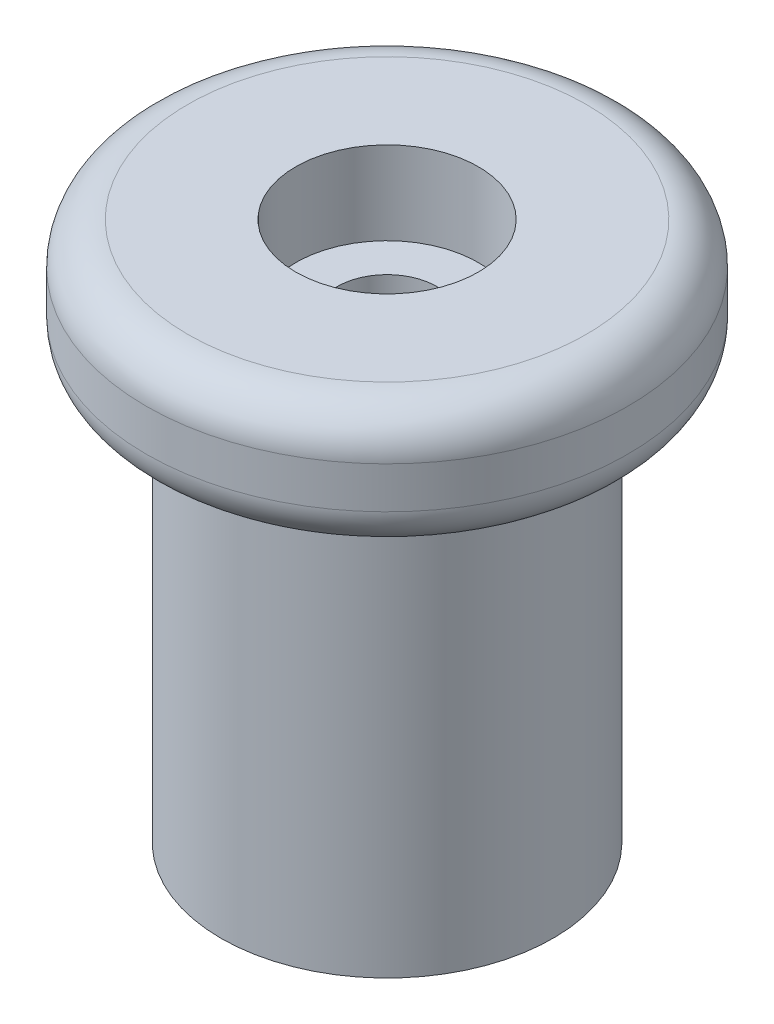
from build123d import *

# Parameters (mm, degrees)
SKETCH_1_R      = 4
EXTRUDE_1_DEPTH = 10
SKETCH_2_R      = 5.8
EXTRUDE_2_DEPTH = 3
FILLET_1_R      = 1


with BuildPart() as part:
    # 草图1 → 凸台-拉伸1 (new body)
    with BuildSketch(Plane(origin=(0, 0, 0), x_dir=(1, 0, 0), z_dir=(0, 1, 0))):
        with Locations(Location((0, 0, 0), (0, 0, 270))):
            Circle(SKETCH_1_R)
    extrude(amount=EXTRUDE_1_DEPTH)

    # 草图2 → 凸台-拉伸2 (add)
    with BuildSketch(Plane(origin=(0, 10, 0), x_dir=(1, 0, 0), z_dir=(0, 1, 0))):
        with Locations(Location((0, 0, 0), (0, 0, 270))):
            Circle(SKETCH_2_R)
    extrude(amount=EXTRUDE_2_DEPTH)

    # 草图4 → M2 凹头盖螺钉的柱形沉头孔1 (revolve, cut)
    with BuildSketch(Plane(origin=(0, 13, 0), x_dir=(0, 0, 1), z_dir=(1, 0, 0))):
        Polygon((0, 0), (0, 13), (1.2, 13), (1.2, 2), (2.2, 2), (2.2, 0), align=None)
    revolve(axis=Axis((0, 19.35, 0), (0, -1, 0)), mode=Mode.SUBTRACT)

    # 圆角1
    fillet_1_edges = [part.edges().sort_by_distance(p)[0] for p in [
        (0, 10, -5.8),
        (0, 13, -5.8),
    ]]
    fillet(fillet_1_edges, radius=FILLET_1_R)


solid = part.part
